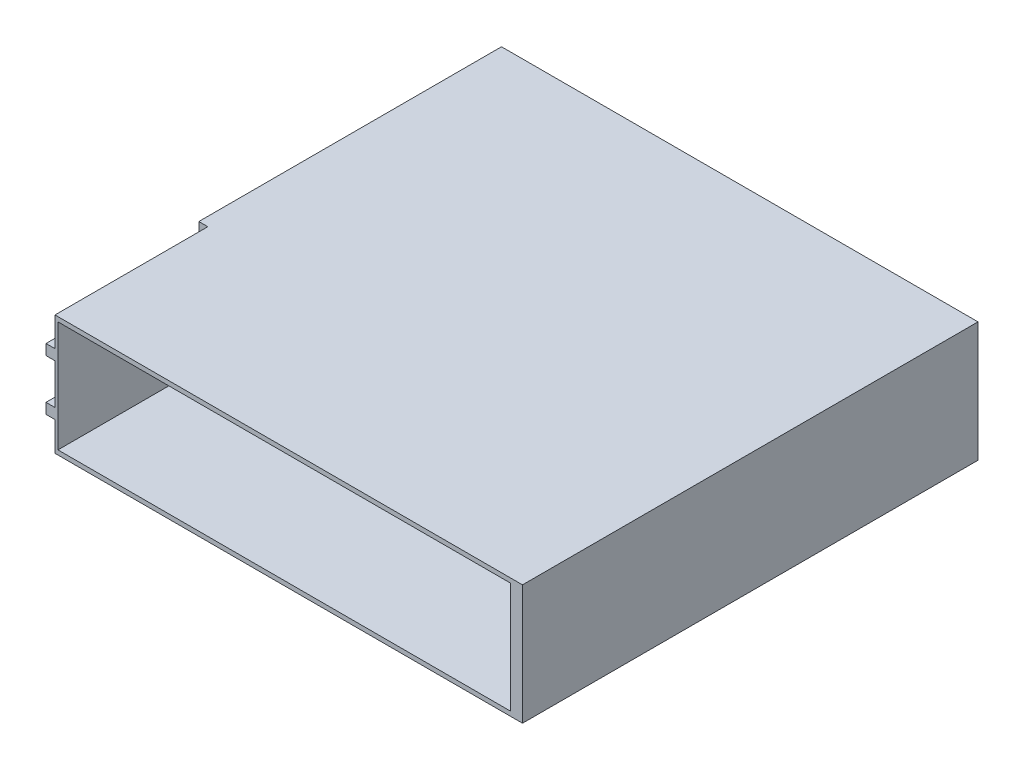
from build123d import *

# Parameters (mm, degrees)
ESQUISSE1_W             = 159
ESQUISSE1_H             = 40
BOSS_EXTRU_1_DEPTH      = 2
ESQUISSE2_W             = 159
ESQUISSE2_H             = 40
ESQUISSE2_W_2           = 151
ESQUISSE2_H_2           = 37
BOSS_EXTRU_2_DEPTH      = 150
ESQUISSE3_W             = 51
ESQUISSE3_H             = 9.75
ESQUISSE3_H_2           = 13.5
ENL_V_MAT_EXTRU_1_DEPTH = 3


with BuildPart() as part:
    # Esquisse1 → Boss.-Extru.1 (new body)
    with BuildSketch(Plane.XY):
        with Locations((79.5, 20)):
            Rectangle(ESQUISSE1_W, ESQUISSE1_H)
    extrude(amount=BOSS_EXTRU_1_DEPTH)

    # Esquisse2 → Boss.-Extru.2 (add)
    with BuildSketch(Plane.XY.offset(2)):
        with Locations((79.5, 20)):
            Rectangle(ESQUISSE2_W, ESQUISSE2_H)
        with Locations((79.5, 20)):
            Rectangle(ESQUISSE2_W_2, ESQUISSE2_H_2, mode=Mode.SUBTRACT)
    extrude(amount=BOSS_EXTRU_2_DEPTH)

    # Esquisse3 → Enlèv. mat.-Extru.1 (cut)
    with BuildSketch(Plane.ZY):
        with Locations((126.5, 35.125)):
            Rectangle(ESQUISSE3_W, ESQUISSE3_H)
        with Locations((126.5, 20)):
            Rectangle(ESQUISSE3_W, ESQUISSE3_H_2)
        with Locations((126.5, 4.875)):
            Rectangle(ESQUISSE3_W, ESQUISSE3_H)
    extrude(amount=-ENL_V_MAT_EXTRU_1_DEPTH, mode=Mode.SUBTRACT)


solid = part.part
